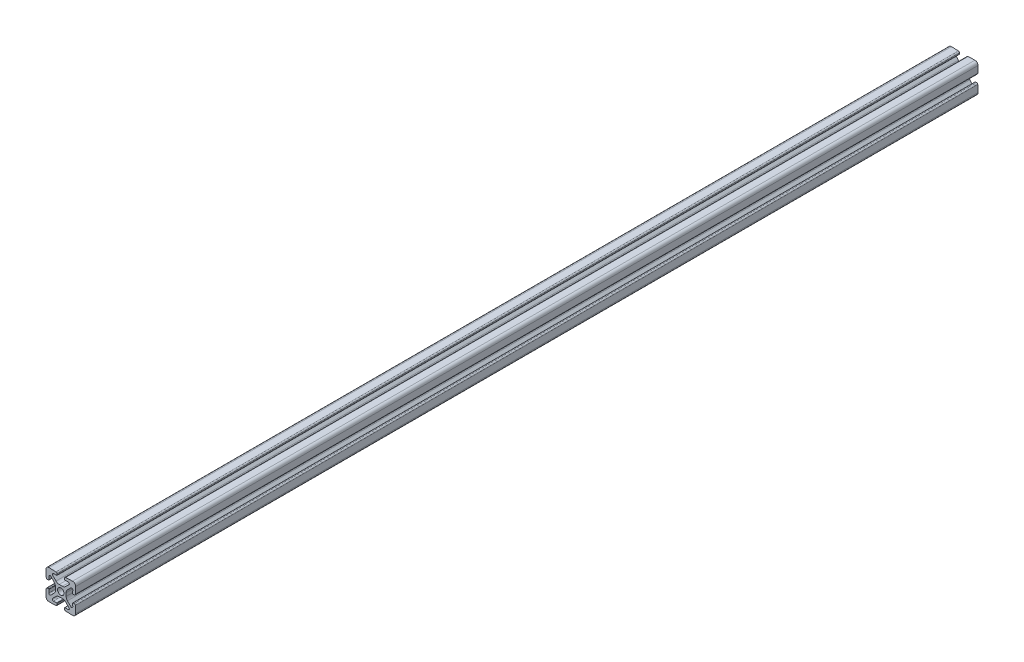
from build123d import *

# Parameters (mm, degrees)
BOSS_EXTRUDE1_DEPTH = 304.8
CIRPATTERN1_COUNT   = 4


with BuildPart() as part:
    # Sketch3 → Boss-Extrude1 (new, symmetric)
    with BuildSketch(Plane.XY):
        with BuildLine():
            Line((-2.524916986, 8.30911066), (-2.500487338, 9.008684239))
            ThreePointArc((-2.500487338, 9.008684239), (-2.714917039, 9.582202525), (-3.272080403, 9.836116498))
            Line((-3.272080403, 9.836116498), (-7.930201007, 9.998781654))
            ThreePointArc((-7.930201007, 9.998781654), (-9.414213562, 9.414213562), (-9.998781654, 7.930201007))
            Line((-9.998781654, 7.930201007), (-9.836116498, 3.272080403))
            ThreePointArc((-9.836116498, 3.272080403), (-9.582202525, 2.714917039), (-9.008684239, 2.500487338))
            Line((-9.008684239, 2.500487338), (-8.30911066, 2.524916986))
            ThreePointArc((-8.30911066, 2.524916986), (-8.100174399, 2.620134726), (-8.019763261, 2.835204083))
            Line((-8.019763261, 2.835204083), (-8.093719461, 4.953032548))
            ThreePointArc((-8.093719461, 4.953032548), (-7.631170264, 5.686128657), (-6.779559917, 5.52444538))
            Line((-6.779559917, 5.52444538), (-4.478679656, 3.22356512))
            ThreePointArc((-4.478679656, 3.22356512), (-3.828361402, 2.250295073), (-3.6, 1.102244776))
            Line((-3.6, 1.102244776), (-3.6, 0))
            Line((-3.6, 0), (-2.15, 0))
            ThreePointArc((-2.15, 0), (-1.52027958, 1.52027958), (0, 2.15))
            Line((0, 2.15), (0, 3.6))
            Line((0, 3.6), (-1.102244776, 3.6))
            ThreePointArc((-1.102244776, 3.6), (-2.250295073, 3.828361402), (-3.22356512, 4.478679656))
            Line((-3.22356512, 4.478679656), (-5.52444538, 6.779559917))
            ThreePointArc((-5.52444538, 6.779559917), (-5.686128657, 7.631170264), (-4.953032548, 8.093719461))
            Line((-4.953032548, 8.093719461), (-2.835204083, 8.019763261))
            ThreePointArc((-2.835204083, 8.019763261), (-2.620134726, 8.100174399), (-2.524916986, 8.30911066))
        make_face()
    boss_extrude1 = extrude(amount=BOSS_EXTRUDE1_DEPTH, both=True)

    # CirPattern1: Boss-Extrude1 ×4 about axis
    cirpattern1_axis = Axis((0, 0, 0), (0, 0, 1))
    for i in range(1, CIRPATTERN1_COUNT):
        add(boss_extrude1.rotate(cirpattern1_axis, i * 360 / CIRPATTERN1_COUNT))


solid = part.part
